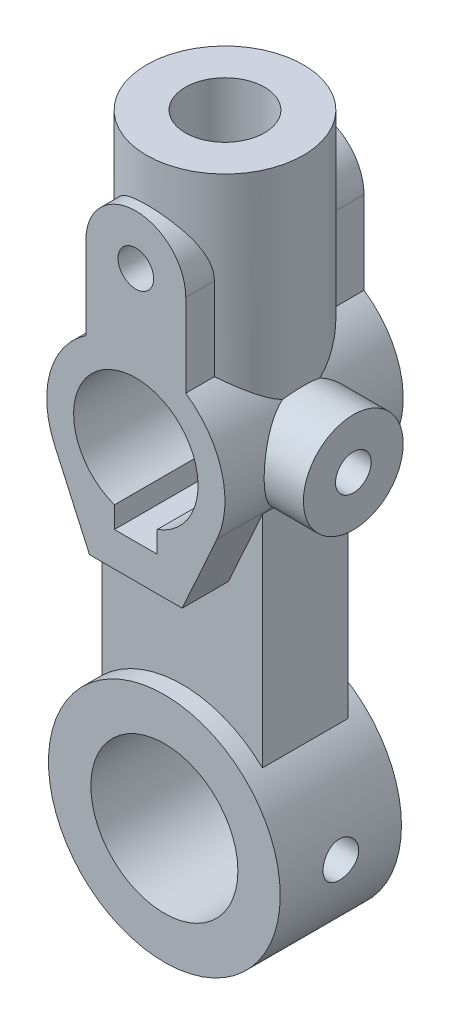
from build123d import *

# Parameters (mm, degrees)
CROQUIS1_R                   = 32.5
SALIENTE_EXTRUIR1_DEPTH      = 34
SALIENTE_EXTRUIR3_DEPTH      = 12
SALIENTE_EXTRUIR3_DEPTH_BACK = 12
CROQUIS2_W                   = 45
CROQUIS2_H                   = 96
CROQUIS4_R                   = 20.625
CORTAR_EXTRUIR1_DEPTH        = 107.90299341
CROQUIS6_R                   = 22
SALIENTE_EXTRUIR4_DEPTH      = 70
SALIENTE_EXTRUIR5_DEPTH      = 13
SALIENTE_EXTRUIR5_DEPTH_BACK = 37
CROQUIS9_R                   = 14
SALIENTE_EXTRUIR6_DEPTH      = 36
CROQUIS10_R                  = 5
CORTAR_EXTRUIR3_DEPTH        = 178.064959973
CROQUIS12_R                  = 11.1
CORTAR_EXTRUIR4_DEPTH        = 70
CROQUIS13_R                  = 5
CORTAR_EXTRUIR5_DEPTH        = 36
CROQUIS14_R                  = 5
CORTAR_EXTRUIR7_DEPTH        = 175.974283964


with BuildPart() as part:
    # Croquis1 → Saliente-Extruir1 (new body)
    with BuildSketch(Plane.XY):
        Circle(CROQUIS1_R)
    extrude(amount=SALIENTE_EXTRUIR1_DEPTH)

    # Croquis2 → Saliente-Extruir3 (add, two sides: drawn at the far end of the back side and taken through both)
    with BuildSketch(Plane.XY.offset(17).offset(-SALIENTE_EXTRUIR3_DEPTH_BACK)):
        with Locations((0, 48)):
            Rectangle(CROQUIS2_W, CROQUIS2_H)
    extrude(amount=SALIENTE_EXTRUIR3_DEPTH + SALIENTE_EXTRUIR3_DEPTH_BACK)

    # Croquis4 → Cortar-Extruir1 (cut, through all)
    with BuildSketch(Plane.XY.offset(34)):
        Circle(CROQUIS4_R)
    extrude(amount=-CORTAR_EXTRUIR1_DEPTH, mode=Mode.SUBTRACT)

    # Croquis6 → Saliente-Extruir4 (add)
    with BuildSketch(Plane(origin=(0, 96, 0), x_dir=(1, 0, 0), z_dir=(0, 1, 0))):
        with Locations(Location((0, -17, 0), (0, 0, 33.055731151))):
            Circle(CROQUIS6_R)
    extrude(amount=SALIENTE_EXTRUIR4_DEPTH)

    # Croquis7 → Saliente-Extruir5 (add, two sides: drawn at the far end of the back side and taken through both)
    with BuildSketch(Plane.XY.offset(29).offset(-SALIENTE_EXTRUIR5_DEPTH_BACK)):
        with BuildLine():
            Line((-13, 64), (13, 64))
            Line((13, 64), (22.792288735, 85.728117298))
            ThreePointArc((22.792288735, 85.728117298), (24.050431537, 102.824715589), (14, 116.712315177))
            Line((14, 116.712315177), (14, 140))
            ThreePointArc((14, 140), (0, 154), (-14, 140))
            Line((-14, 140), (-14, 116.712315177))
            ThreePointArc((-14, 116.712315177), (-24.050431537, 102.824715589), (-22.792288735, 85.728117298))
            Line((-22.792288735, 85.728117298), (-13, 64))
        make_face()
    extrude(amount=SALIENTE_EXTRUIR5_DEPTH + SALIENTE_EXTRUIR5_DEPTH_BACK)

    # Croquis9 → Saliente-Extruir6 (add)
    with BuildSketch(Plane(origin=(0, 0, 0), x_dir=(0, 0, -1), z_dir=(1, 0, 0))):
        with Locations(Location((-17, 96, 0), (0, 0, 308.736531185))):
            Circle(CROQUIS9_R)
    extrude(amount=SALIENTE_EXTRUIR6_DEPTH)

    # Croquis10 → Cortar-Extruir3 (cut, through all)
    with BuildSketch(Plane.XY.offset(42)):
        with Locations((0, 140)):
            Circle(CROQUIS10_R)
        with BuildLine():
            Line((-6, 73.61), (6, 73.61))
            Line((6, 73.61), (6, 79.613954107))
            ThreePointArc((6, 79.613954107), (0, 113.45), (-6, 79.613954107))
            Line((-6, 79.613954107), (-6, 73.61))
        make_face()
    extrude(amount=-CORTAR_EXTRUIR3_DEPTH, mode=Mode.SUBTRACT)

    # Croquis12 → Cortar-Extruir4 (cut)
    with BuildSketch(Plane(origin=(0, 166, 0), x_dir=(1, 0, 0), z_dir=(0, 1, 0))):
        with Locations(Location((0, -17, 0), (0, 0, 270))):
            Circle(CROQUIS12_R)
    extrude(amount=-CORTAR_EXTRUIR4_DEPTH, mode=Mode.SUBTRACT)

    # Croquis13 → Cortar-Extruir5 (cut)
    with BuildSketch(Plane(origin=(36, 0, 0), x_dir=(0, 0, -1), z_dir=(1, 0, 0))):
        with Locations(Location((-17, 96, 0), (0, 0, 90))):
            Circle(CROQUIS13_R)
    extrude(amount=-CORTAR_EXTRUIR5_DEPTH, mode=Mode.SUBTRACT)

    # Croquis14 → Cortar-Extruir7 (cut, through all)
    with BuildSketch(Plane(origin=(0, 0, 0), x_dir=(0, 0, -1), z_dir=(1, 0, 0))):
        with Locations((-17, 0)):
            Circle(CROQUIS14_R)
    extrude(amount=CORTAR_EXTRUIR7_DEPTH, mode=Mode.SUBTRACT)


solid = part.part
